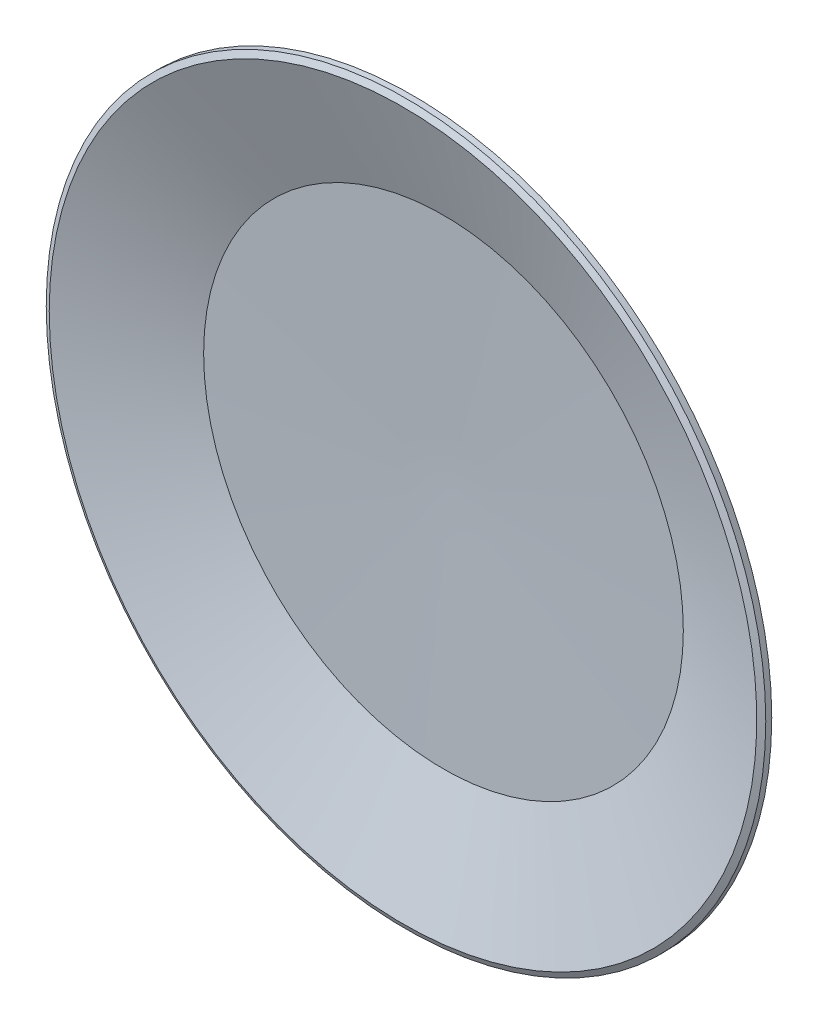
from build123d import *


with BuildPart() as part:
    # Sketch1 → Revolve1 (revolve)
    with BuildSketch(Plane(origin=(0, 0, 0), x_dir=(-1, 0, 0), z_dir=(0, 1, 0)), mode=Mode.PRIVATE) as revolve1_sk:
        Polygon((0, 2), (-66, 2), (-68, 0), (-72, 0), (-74, 2.5), (-82, 5), (-120, 19), (-120, 21), (-118, 22), (-80, 8.5), (0, 6.5), align=None)
    revolve(revolve1_sk.sketch.rotate(Axis((0, 0, -500), (0, 0, 1)), 180), axis=Axis((0, 0, -500), (0, 0, 1)))


solid = part.part
